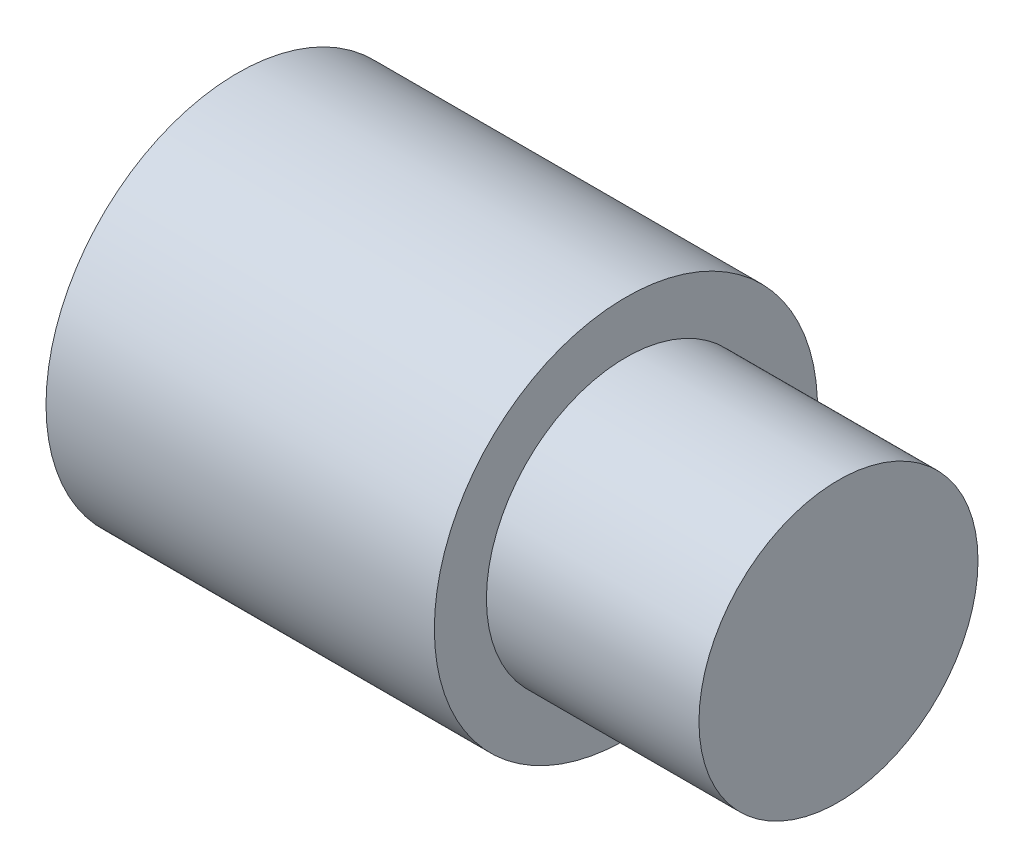
from build123d import *

# Parameters (mm, degrees)
SOCKET_SKETCH_W = 16.2
SOCKET_SKETCH_H = 3.175


with BuildPart() as part:
    # Conn_T4_ORB8 Sketch → Conn_T4_ORB8 (revolve)
    with BuildSketch(Plane.XY):
        Polygon((13.3, 0), (13.3, 8.73), (0, 8.73), (0, 11.988), (-24.3, 11.988), (-24.3, 0), align=None)
    revolve(axis=Axis((-1000, 0, 0), (1, 0, 0)))

    # Socket Sketch → Socket (revolve, cut)
    with BuildSketch(Plane.XY):
        with Locations((-17.2, 1.5875)):
            Rectangle(SOCKET_SKETCH_W, SOCKET_SKETCH_H)
    revolve(axis=Axis((-1000, 0, 0), (1, 0, 0)), mode=Mode.SUBTRACT)


solid = part.part
